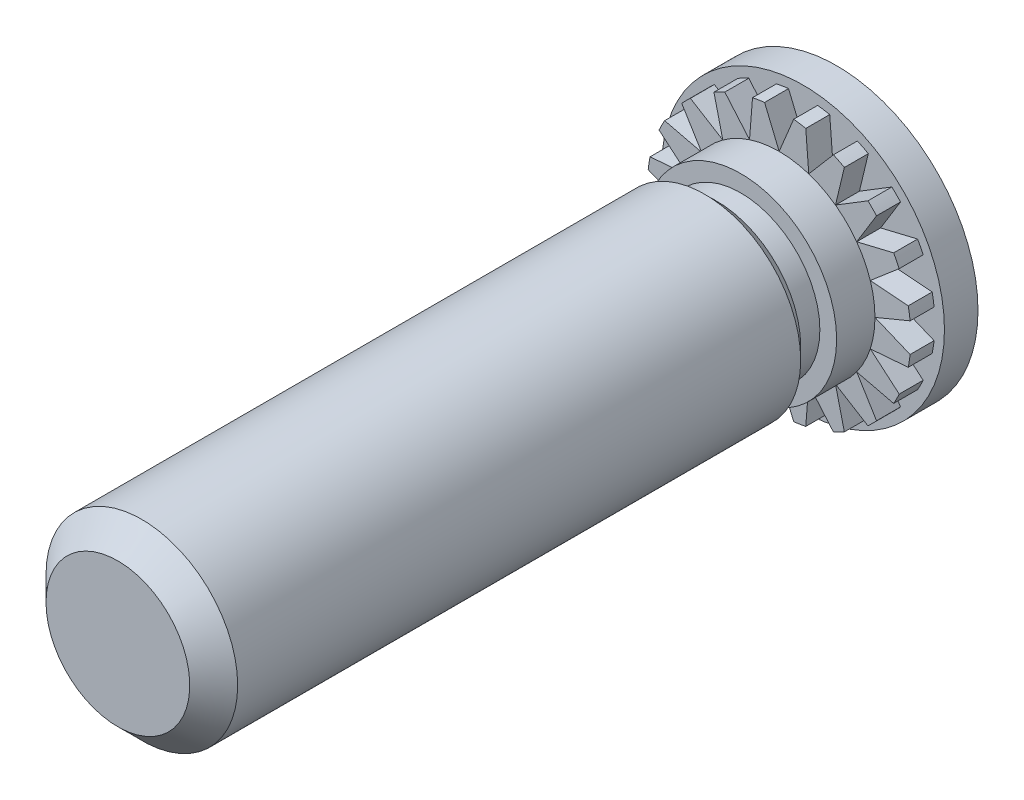
from build123d import *

# Parameters (mm, degrees)
SKETCH_1_R               = 2.95
EXTRUDE_1_DEPTH          = 1.2
SKETCH_2_R               = 2
EXTRUDE_2_DEPTH          = 1.9
CUT_EXTRUDE_1_DEPTH      = 0.5
PATTERN_CIRCULAR_1_COUNT = 20
SKETCH_4_W               = 0.35
SKETCH_4_H               = 0.5
SKETCH_6_W               = 11.9
SKETCH_6_H               = 2
CHAMFER_2_SIZE           = 0.5
CUT_EXTRUDE_START        = -0.5
SKETCH_7_R               = 2.95
SKETCH_7_R_2             = 2.75
CUT_EXTRUDE_2_DEPTH      = 0.5
CHAMFER_3_SIZE           = 0.25


with BuildPart() as part:
    # Эскиз1 → Вытянуть1 (new body)
    with BuildSketch(Plane.XY):
        Circle(SKETCH_1_R)
    extrude(amount=EXTRUDE_1_DEPTH)

    # Эскиз2 → Вытянуть2 (add)
    with BuildSketch(Plane.XY.offset(1.2)):
        with Locations(Location((0, 0, 0), (0, 0, 180))):
            Circle(SKETCH_2_R)
    extrude(amount=EXTRUDE_2_DEPTH)

    # Эскиз3 → Вырез-Вытянуть1 (cut)
    with BuildSketch(Plane.XY.offset(1.2)):
        Polygon((-0.393502884, 2.95), (0.393502884, 2.95), (0, 2), align=None)
    cut_extrude_1 = extrude(amount=-CUT_EXTRUDE_1_DEPTH, mode=Mode.SUBTRACT)

    # Круговой массив1: Вырез-Вытянуть1 ×20 about axis
    pattern_circular_1_axis = Axis((0, 0, 0), (0, 0, 1))
    for i in range(1, PATTERN_CIRCULAR_1_COUNT):
        add(cut_extrude_1.rotate(pattern_circular_1_axis, i * 360 / PATTERN_CIRCULAR_1_COUNT), mode=Mode.SUBTRACT)

    # Эскиз4 → Вырез-Повернуть1 (revolve, cut)
    with BuildSketch(Plane(origin=(0, 0, 0), x_dir=(1, 0, 0), z_dir=(0, 1, 0)), mode=Mode.PRIVATE) as cut_revolve_1_sk:
        with Locations((1.825, -2.25)):
            Rectangle(SKETCH_4_W, SKETCH_4_H)
    revolve(cut_revolve_1_sk.sketch.rotate(Axis((0, 0, 10.642619983), (0, 0, -1)), 172.537215717), axis=Axis((0, 0, 10.642619983), (0, 0, -1)), mode=Mode.SUBTRACT)

    # Эскиз6 → Повернуть1 (revolve)
    with BuildSketch(Plane(origin=(0, 0, 0), x_dir=(0, 0, -1), z_dir=(1, 0, 0)), mode=Mode.PRIVATE) as revolve_1_sk:
        with Locations((-9.05, -1)):
            Rectangle(SKETCH_6_W, SKETCH_6_H)
    revolve(revolve_1_sk.sketch.rotate(Axis((0, 0, 3.1), (0, 0, 1)), 277.462784283), axis=Axis((0, 0, 3.1), (0, 0, 1)))

    # Фаска2
    chamfer_2_edges = [part.edges().sort_by_distance(p)[0] for p in [
        (1.983058868, 0.25976437, 15),
    ]]
    chamfer(chamfer_2_edges, length=CHAMFER_2_SIZE)

    # Эскиз7 → Вырез-Вытянуть2 (cut)
    with BuildSketch(Plane.XY.offset(1.2).offset(CUT_EXTRUDE_START)):
        with Locations(Location((0, 0, 0), (0, 0, 180))):
            Circle(SKETCH_7_R)
        Circle(SKETCH_7_R_2, mode=Mode.SUBTRACT)
    extrude(amount=CUT_EXTRUDE_2_DEPTH, mode=Mode.SUBTRACT)

    # Фаска3
    chamfer_3_edges = [part.edges().sort_by_distance(p)[0] for p in [
        (2, 0, 2.5),
    ]]
    chamfer(chamfer_3_edges, length=CHAMFER_3_SIZE)


solid = part.part
